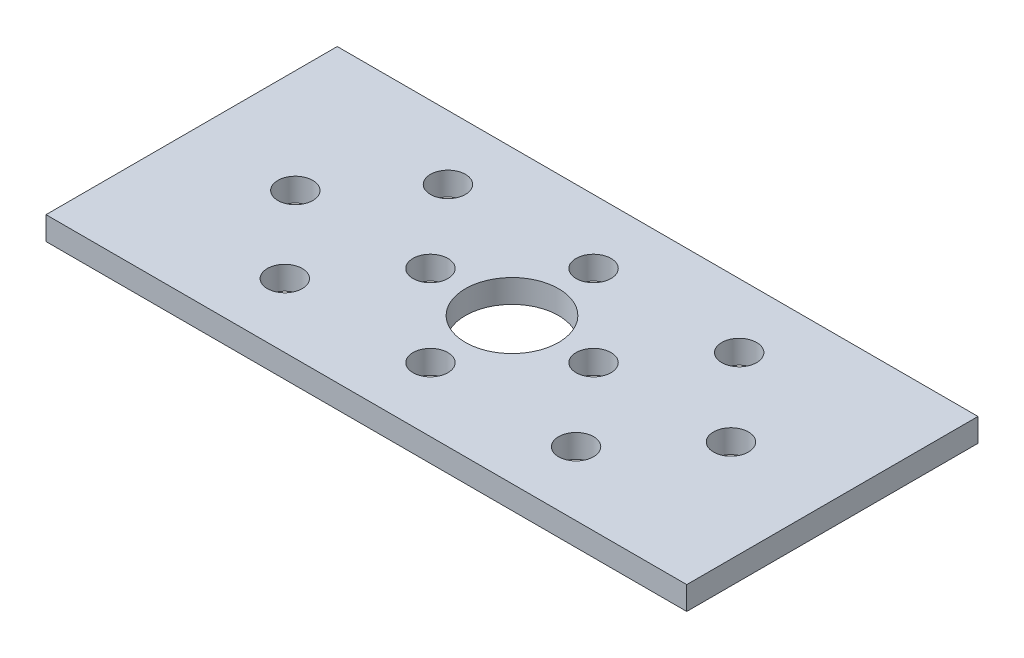
from build123d import *

# Parameters (mm, degrees)
SKETCH_1_W      = 55
SKETCH_1_H      = 25
SKETCH_1_R      = 1.5
SKETCH_1_R_2    = 4
EXTRUDE_1_DEPTH = 2


with BuildPart() as part:
    # 草图1 → 凸台-拉伸1 (new body)
    with BuildSketch(Plane(origin=(0, 0, 0), x_dir=(1, 0, 0), z_dir=(0, 1, 0))):
        Rectangle(SKETCH_1_W, SKETCH_1_H)
        with Locations(Location((0, 7, 0), (0, 0, 270))):
            Circle(SKETCH_1_R, mode=Mode.SUBTRACT)
        with Locations(Location((7, 0, 0), (0, 0, 270))):
            Circle(SKETCH_1_R, mode=Mode.SUBTRACT)
        with Locations(Location((0, -7, 0), (0, 0, 270))):
            Circle(SKETCH_1_R, mode=Mode.SUBTRACT)
        with Locations(Location((-7, 0, 0), (0, 0, 270))):
            Circle(SKETCH_1_R, mode=Mode.SUBTRACT)
        with Locations(Location((-18.598687937, 0, 0), (0, 0, 270))):
            Circle(SKETCH_1_R, mode=Mode.SUBTRACT)
        with Locations(Location((0, 0, 0), (0, 0, 270))):
            Circle(SKETCH_1_R_2, mode=Mode.SUBTRACT)
        with Locations(Location((18.795941944, 0, 0), (0, 0, 270))):
            Circle(SKETCH_1_R, mode=Mode.SUBTRACT)
        with Locations(Location((12.5, 7, 0), (0, 0, 270))):
            Circle(SKETCH_1_R, mode=Mode.SUBTRACT)
        with Locations(Location((12.5, -7, 0), (0, 0, 90))):
            Circle(SKETCH_1_R, mode=Mode.SUBTRACT)
        with Locations(Location((-12.5, -7, 0), (0, 0, 270))):
            Circle(SKETCH_1_R, mode=Mode.SUBTRACT)
        with Locations(Location((-12.5, 7, 0), (0, 0, 90))):
            Circle(SKETCH_1_R, mode=Mode.SUBTRACT)
    extrude(amount=EXTRUDE_1_DEPTH)


solid = part.part
